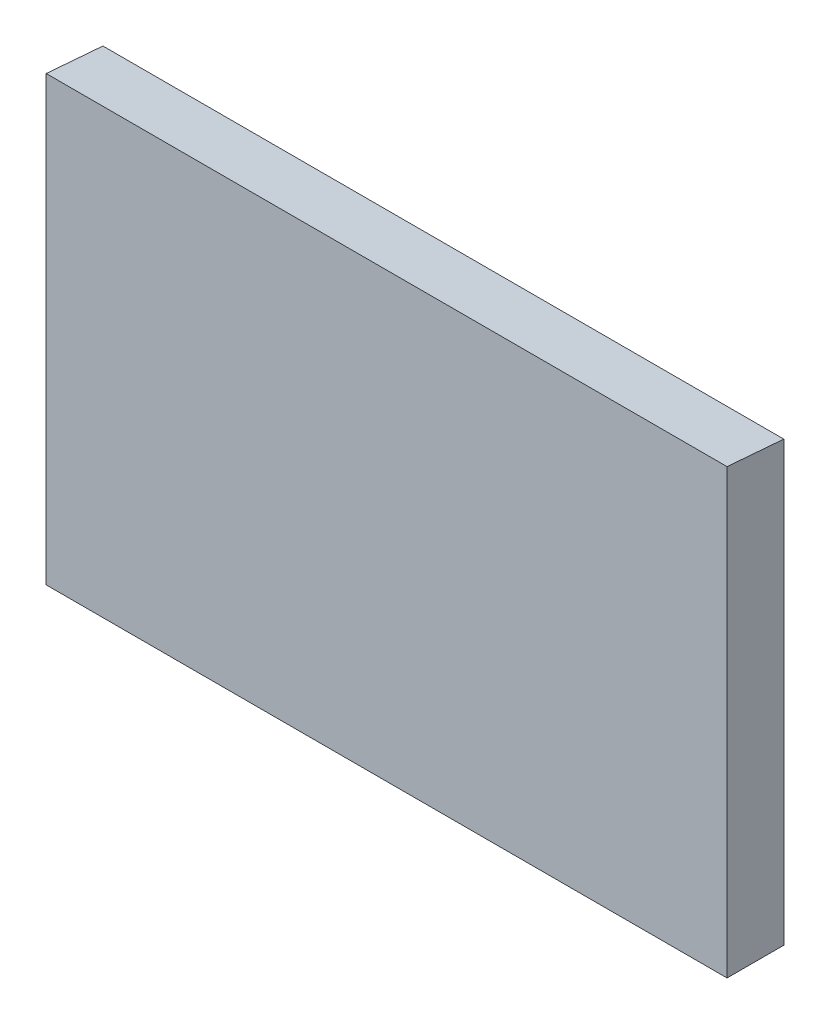
from build123d import *

# Parameters (mm, degrees)
CROQUIS1_W              = 15
CROQUIS1_H              = 115.68
SALIENTE_EXTRUIR1_DEPTH = 180
SALIENTE_EXTRUIR3_DEPTH = 180


with BuildPart() as part:
    # Croquis1 → Saliente-Extruir1 (new body)
    with BuildSketch(Plane(origin=(0, 0, 0), x_dir=(0, 0, -1), z_dir=(1, 0, 0))):
        Rectangle(CROQUIS1_W, CROQUIS1_H)
    extrude(amount=SALIENTE_EXTRUIR1_DEPTH)

    # Croquis3 → Saliente-Extruir3 (add, through all)
    with BuildSketch(Plane(origin=(180, 0, 0), x_dir=(0, 0, -1), z_dir=(1, 0, 0))):
        Polygon((7.5, 57.84), (-7.5, 57.84), (-7.5, 59.24), (7.5, 58.04), align=None)
    extrude(amount=-SALIENTE_EXTRUIR3_DEPTH)


solid = part.part
